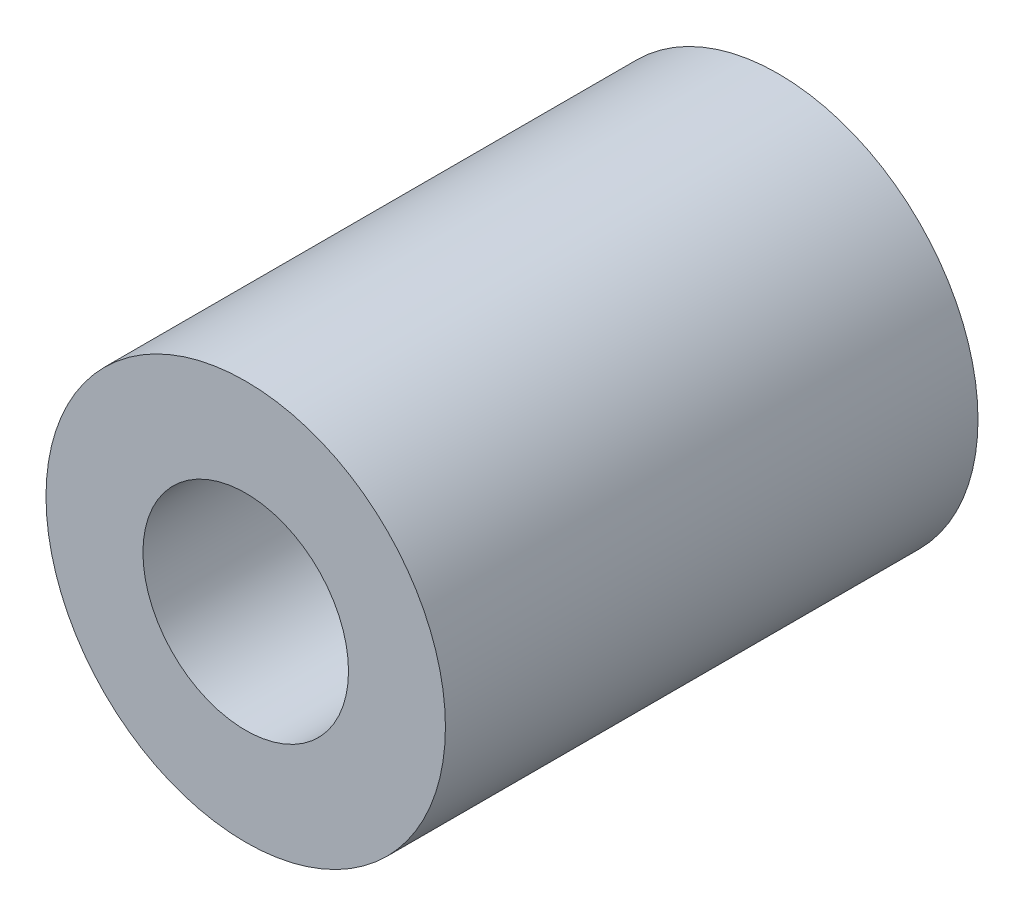
from build123d import *

# Parameters (mm, degrees)
SKETCH1_R           = 4.7625
SKETCH1_R_2         = 2.4511
BOSS_EXTRUDE1_DEPTH = 12.7


with BuildPart() as part:
    # Sketch1 → Boss-Extrude1 (new body)
    with BuildSketch(Plane.XY):
        Circle(SKETCH1_R)
        Circle(SKETCH1_R_2, mode=Mode.SUBTRACT)
    extrude(amount=BOSS_EXTRUDE1_DEPTH)


solid = part.part
